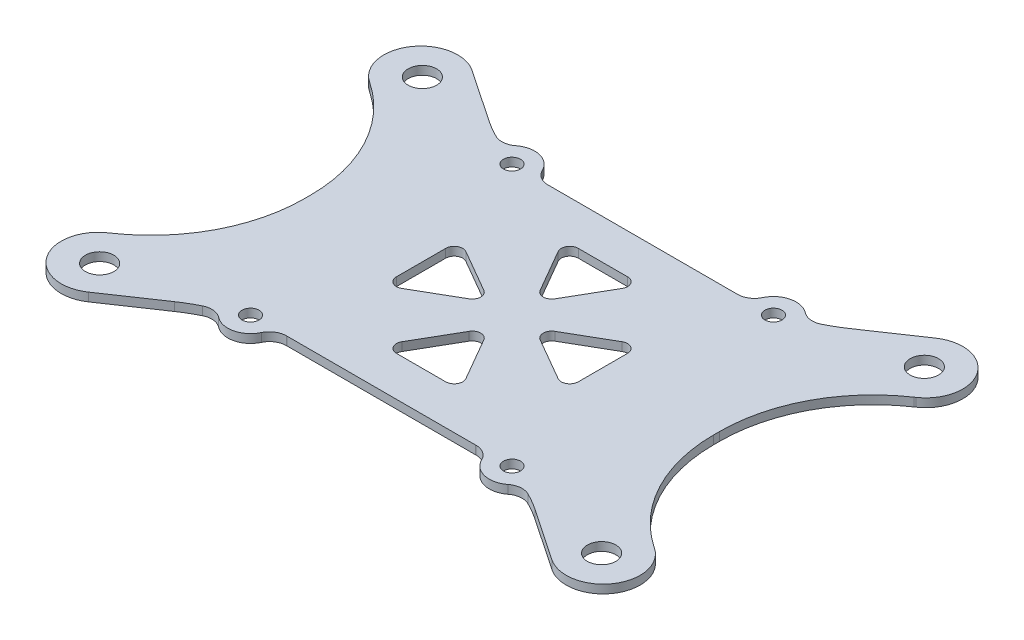
from build123d import *

# Parameters (mm, degrees)
SKETCH1_W           = 72
SKETCH1_H           = 46
BOSS_EXTRUDE1_DEPTH = 1.5
BOSS_EXTRUDE2_DEPTH = 1.5
FILLET1_R           = 27
FILLET2_R           = 27
SKETCH4_R           = 2.5
CUT_EXTRUDE1_DEPTH  = 62.746995832
CUT_EXTRUDE2_DEPTH  = 62.746995832
SKETCH6_R           = 4
BOSS_EXTRUDE3_DEPTH = 1.5
SKETCH7_R           = 1.5
CUT_EXTRUDE3_DEPTH  = 62.746995832
FILLET3_R           = 3


with BuildPart() as part:
    # Sketch1 → Boss-Extrude1 (new body)
    with BuildSketch(Plane(origin=(0, 0, 0), x_dir=(1, 0, 0), z_dir=(0, 1, 0))):
        Rectangle(SKETCH1_W, SKETCH1_H)
    extrude(amount=BOSS_EXTRUDE1_DEPTH)

    # Sketch2 → Boss-Extrude2 (add)
    with BuildSketch(Plane(origin=(0, 0, 0), x_dir=(-1, 0, 0), z_dir=(0, -1, 0))):
        with BuildLine():
            Line((48.068898708, -23), (31.543816429, -11.821602429))
            Line((31.543816429, -11.821602429), (24.259944208, -22.589387971))
            Line((24.259944208, -22.589387971), (40.785026488, -33.767785542))
            ThreePointArc((40.785026488, -33.767785542), (49.810855369, -32.025828881), (48.068898708, -23))
        make_face()
        with BuildLine():
            Line((48.068898708, 23), (32.081337837, 12.185208969))
            Line((32.081337837, 12.185208969), (24.797465617, 22.952994511))
            Line((24.797465617, 22.952994511), (40.785026488, 33.767785542))
            ThreePointArc((40.785026488, 33.767785542), (49.810855369, 32.025828881), (48.068898708, 23))
        make_face()
        with BuildLine():
            Line((-40.785026488, 33.767785542), (-24.516772197, 22.763119351))
            Line((-24.516772197, 22.763119351), (-31.800644417, 11.995333809))
            Line((-31.800644417, 11.995333809), (-48.068898708, 23))
            ThreePointArc((-48.068898708, 23), (-49.810855369, 32.025828881), (-40.785026488, 33.767785542))
        make_face()
        with BuildLine():
            Line((-48.068898708, -23), (-31.591450786, -11.853824706))
            Line((-31.591450786, -11.853824706), (-24.307578566, -22.621610248))
            Line((-24.307578566, -22.621610248), (-40.785026488, -33.767785542))
            ThreePointArc((-40.785026488, -33.767785542), (-49.810855369, -32.025828881), (-48.068898708, -23))
        make_face()
    extrude(amount=-BOSS_EXTRUDE2_DEPTH)

    # Fillet1
    fillet1_edges = [part.edges().sort_by_distance(p)[0] for p in [
        (36, 0.75, -14.835989333),
        (36, 0.75, 14.835989333),
        (-36, 0.75, -14.835989333),
        (-36, 0.75, 14.835989333),
    ]]
    fillet(fillet1_edges, radius=FILLET1_R)

    # Fillet2
    fillet2_edges = [part.edges().sort_by_distance(p)[0] for p in [
        (24.866954071, 0.75, -23),
        (24.866954071, 0.75, 23),
        (-24.866954071, 0.75, -23),
        (-24.866954071, 0.75, 23),
    ]]
    fillet(fillet2_edges, radius=FILLET2_R)

    # Sketch4 → Cut-Extrude1 (cut, through all)
    with BuildSketch(Plane(origin=(0, 1.5, 0), x_dir=(1, 0, 0), z_dir=(0, 1, 0))):
        with Locations(Location((-44.160029051, -28.392636972, 0), (0, 0, 270))):
            Circle(SKETCH4_R)
        with Locations(Location((44.160029051, 28.392636972, 0), (0, 0, 270))):
            Circle(SKETCH4_R)
        with Locations(Location((-44.160029051, 28.392636972, 0), (0, 0, 270))):
            Circle(SKETCH4_R)
        with Locations(Location((44.160029051, -28.392636972, 0), (0, 0, 270))):
            Circle(SKETCH4_R)
    extrude(amount=-CUT_EXTRUDE1_DEPTH, mode=Mode.SUBTRACT)

    # Sketch5 → Cut-Extrude2 (cut, through all)
    with BuildSketch(Plane(origin=(0, 1.5, 0), x_dir=(1, 0, 0), z_dir=(0, 1, 0))):
        with BuildLine():
            Line((1.299038106, 6.25), (5.629165125, 13.75))
            ThreePointArc((5.629165125, 13.75), (5.629165125, 15.25), (4.330127019, 16))
            Line((4.330127019, 16), (-4.330127019, 16))
            ThreePointArc((-4.330127019, 16), (-5.629165125, 15.25), (-5.629165125, 13.75))
            Line((-5.629165125, 13.75), (-1.299038106, 6.25))
            ThreePointArc((-1.299038106, 6.25), (0, 5.5), (1.299038106, 6.25))
        make_face()
        with BuildLine():
            Line((-1.299038106, -6.25), (-5.629165125, -13.75))
            ThreePointArc((-5.629165125, -13.75), (-5.629165125, -15.25), (-4.330127019, -16))
            Line((-4.330127019, -16), (4.330127019, -16))
            ThreePointArc((4.330127019, -16), (5.629165125, -15.25), (5.629165125, -13.75))
            Line((5.629165125, -13.75), (1.299038106, -6.25))
            ThreePointArc((1.299038106, -6.25), (0, -5.5), (-1.299038106, -6.25))
        make_face()
        with BuildLine():
            Line((-6.25, 1.299038106), (-13.75, 5.629165125))
            ThreePointArc((-13.75, 5.629165125), (-15.25, 5.629165125), (-16, 4.330127019))
            Line((-16, 4.330127019), (-16, -4.330127019))
            ThreePointArc((-16, -4.330127019), (-15.25, -5.629165125), (-13.75, -5.629165125))
            Line((-13.75, -5.629165125), (-6.25, -1.299038106))
            ThreePointArc((-6.25, -1.299038106), (-5.5, 0), (-6.25, 1.299038106))
        make_face()
        with BuildLine():
            Line((6.25, -1.299038106), (13.75, -5.629165125))
            ThreePointArc((13.75, -5.629165125), (15.25, -5.629165125), (16, -4.330127019))
            Line((16, -4.330127019), (16, 4.330127019))
            ThreePointArc((16, 4.330127019), (15.25, 5.629165125), (13.75, 5.629165125))
            Line((13.75, 5.629165125), (6.25, 1.299038106))
            ThreePointArc((6.25, 1.299038106), (5.5, 0), (6.25, -1.299038106))
        make_face()
    extrude(amount=-CUT_EXTRUDE2_DEPTH, mode=Mode.SUBTRACT)

    # Sketch6 → Boss-Extrude3 (add)
    with BuildSketch(Plane(origin=(0, 1.5, 0), x_dir=(1, 0, 0), z_dir=(0, 1, 0))):
        with Locations((-23, -23)):
            Circle(SKETCH6_R)
        with Locations((-23, 23)):
            Circle(SKETCH6_R)
        with Locations((23, -23)):
            Circle(SKETCH6_R)
        with Locations((23, 23)):
            Circle(SKETCH6_R)
    extrude(amount=-BOSS_EXTRUDE3_DEPTH)

    # Sketch7 → Cut-Extrude3 (cut, through all)
    with BuildSketch(Plane(origin=(0, 1.5, 0), x_dir=(1, 0, 0), z_dir=(0, 1, 0))):
        with Locations(Location((-23, -23, 0), (0, 0, 270))):
            Circle(SKETCH7_R)
        with Locations(Location((-23, 23, 0), (0, 0, 270))):
            Circle(SKETCH7_R)
        with Locations(Location((23, -23, 0), (0, 0, 270))):
            Circle(SKETCH7_R)
        with Locations(Location((23, 23, 0), (0, 0, 270))):
            Circle(SKETCH7_R)
    extrude(amount=-CUT_EXTRUDE3_DEPTH, mode=Mode.SUBTRACT)

    # Fillet3
    fillet3_edges = [part.edges().sort_by_distance(p)[0] for p in [
        (-26.523803708, 0.75, 24.892830532),
        (-19.0014495, 0.75, 23.107674985),
        (-26.523803708, 0.75, -24.892830532),
        (-19.0014495, 0.75, -23.107674985),
        (26.523803708, 0.75, 24.892830532),
        (19.0014495, 0.75, 23.107674985),
        (26.523803708, 0.75, -24.892830532),
        (19.0014495, 0.75, -23.107674985),
    ]]
    fillet(fillet3_edges, radius=FILLET3_R)


solid = part.part
